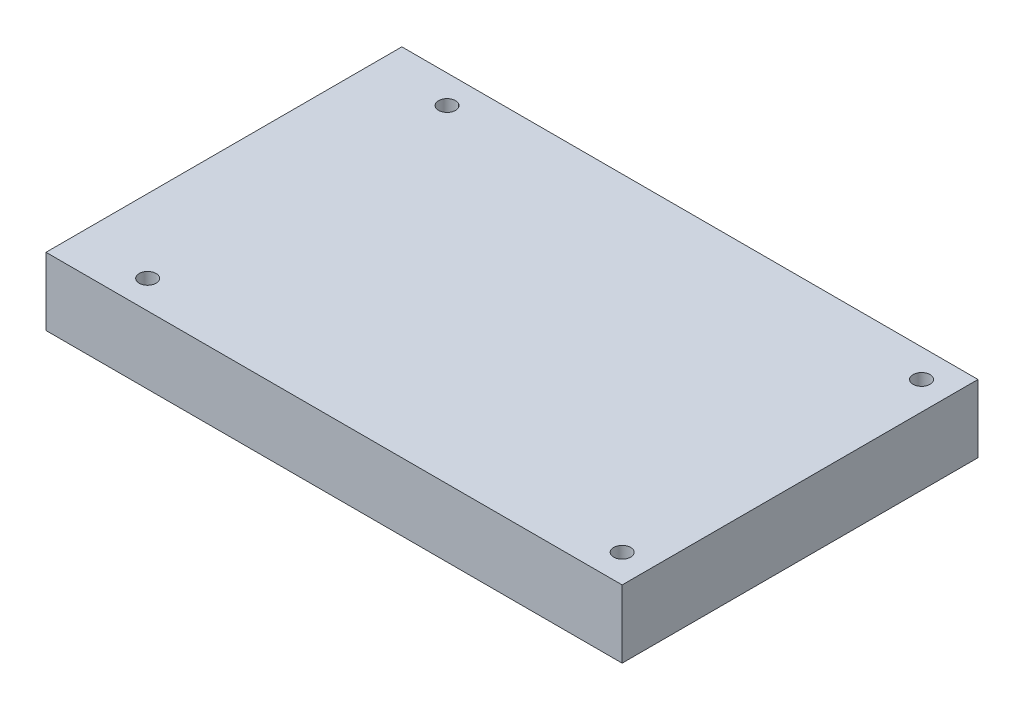
from build123d import *

# Parameters (mm, degrees)
SKETCH1_W           = 102
SKETCH1_H           = 63
BOSS_EXTRUDE1_DEPTH = 12
SKETCH2_R           = 1.5
CUT_EXTRUDE1_DEPTH  = 62.133051617


with BuildPart() as part:
    # Sketch1 → Boss-Extrude1 (new body)
    with BuildSketch(Plane(origin=(0, 0, 0), x_dir=(1, 0, 0), z_dir=(0, 1, 0))):
        Rectangle(SKETCH1_W, SKETCH1_H)
    extrude(amount=BOSS_EXTRUDE1_DEPTH)

    # Sketch2 → Cut-Extrude1 (cut, through all)
    with BuildSketch(Plane(origin=(0, 12, 0), x_dir=(1, 0, 0), z_dir=(0, 1, 0))):
        with Locations(Location((-38, 26.5, 0), (0, 0, 270))):
            Circle(SKETCH2_R)
        with Locations(Location((46, 26.5, 0), (0, 0, 270))):
            Circle(SKETCH2_R)
        with Locations(Location((46, -26.5, 0), (0, 0, 270))):
            Circle(SKETCH2_R)
        with Locations(Location((-38, -26.5, 0), (0, 0, 270))):
            Circle(SKETCH2_R)
    extrude(amount=-CUT_EXTRUDE1_DEPTH, mode=Mode.SUBTRACT)


solid = part.part
